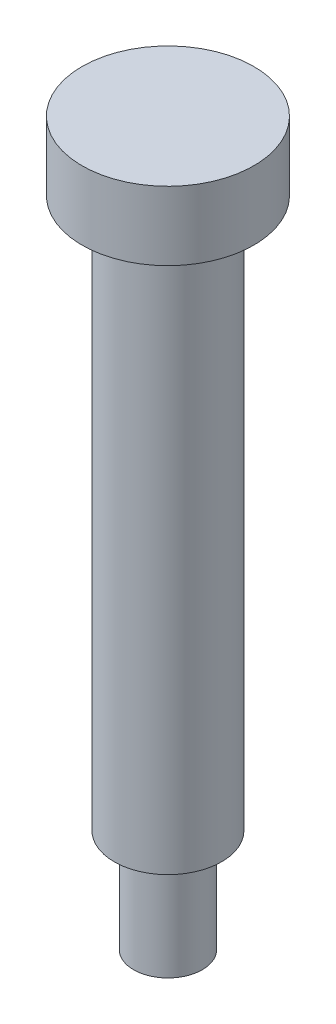
from build123d import *


with BuildPart() as part:
    # Sketch2 → Revolve1 (revolve)
    with BuildSketch(Plane.XY, mode=Mode.PRIVATE) as revolve1_sk:
        Polygon((0, 0), (2, 0), (2, 6), (3.125, 6), (3.125, 38), (5, 38), (5, 42), (0, 42), align=None)
    revolve(revolve1_sk.sketch.rotate(Axis((0, 42, 0), (0, -1, 0)), 180), axis=Axis((0, 42, 0), (0, -1, 0)))


solid = part.part
